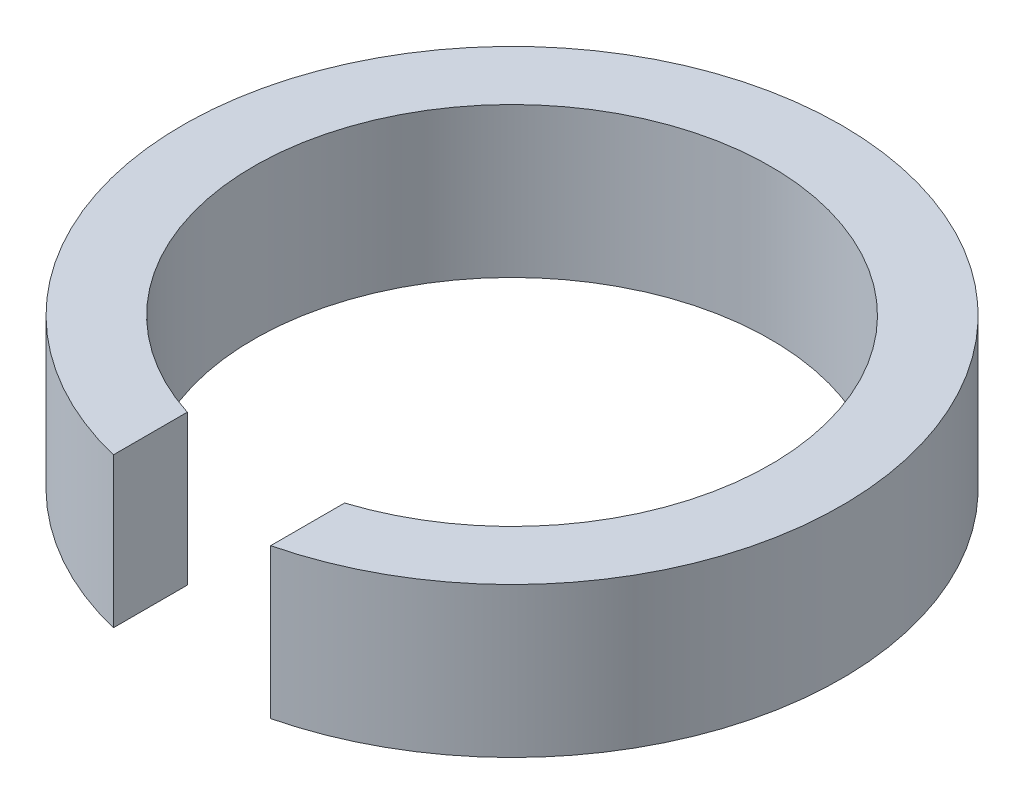
from build123d import *

# Parameters (mm, degrees)
BOSS_EXTRUDE1_DEPTH = 2


with BuildPart() as part:
    # Sketch1 → Boss-Extrude1 (new body)
    with BuildSketch(Plane(origin=(0, 0, 0), x_dir=(1, 0, 0), z_dir=(0, 1, 0))):
        with BuildLine():
            Line((-1.05, -4.272879591), (-1.05, -3.286335345))
            ThreePointArc((-1.05, -3.286335345), (-2.034698995, 2.786126343), (3.45, 0))
            ThreePointArc((3.45, 0), (2.786126343, -2.034698995), (1.05, -3.286335345))
            Line((1.05, -3.286335345), (1.05, -4.272879591))
            ThreePointArc((1.05, -4.272879591), (3.462657939, -2.714774392), (4.4, 0))
            ThreePointArc((4.4, 0), (-2.714774392, 3.462657939), (-1.05, -4.272879591))
        make_face()
    extrude(amount=BOSS_EXTRUDE1_DEPTH)


solid = part.part
